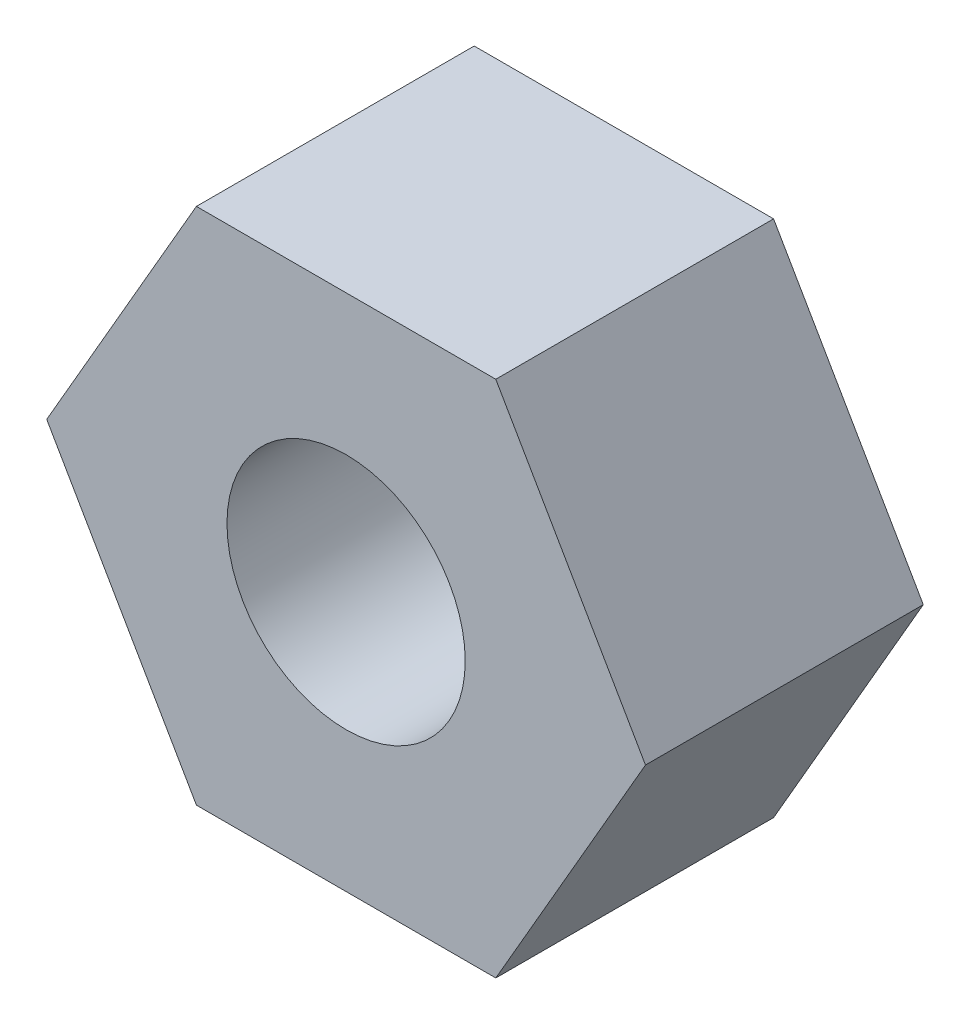
from build123d import *

# Parameters (mm, degrees)
BOSS_EXTRUDE1_DEPTH     = 5.953125
F_1_4_20_TAPPED_HOLE1_D = 5.1054


with BuildPart() as part:
    # Sketch1 → Boss-Extrude1 (new body)
    with BuildSketch(Plane.XY):
        Polygon((-3.207902433, -5.55625), (3.207902433, -5.55625), (6.415804866, 0), (3.207902433, 5.55625), (-3.207902433, 5.55625), (-6.415804866, 0), align=None)
    extrude(amount=BOSS_EXTRUDE1_DEPTH)

    # 1/4-20 Tapped Hole1 (through all)
    with Locations(Plane.XY.offset(5.953125)):
        with Locations((0, 0)):
            Hole(F_1_4_20_TAPPED_HOLE1_D / 2)


solid = part.part
